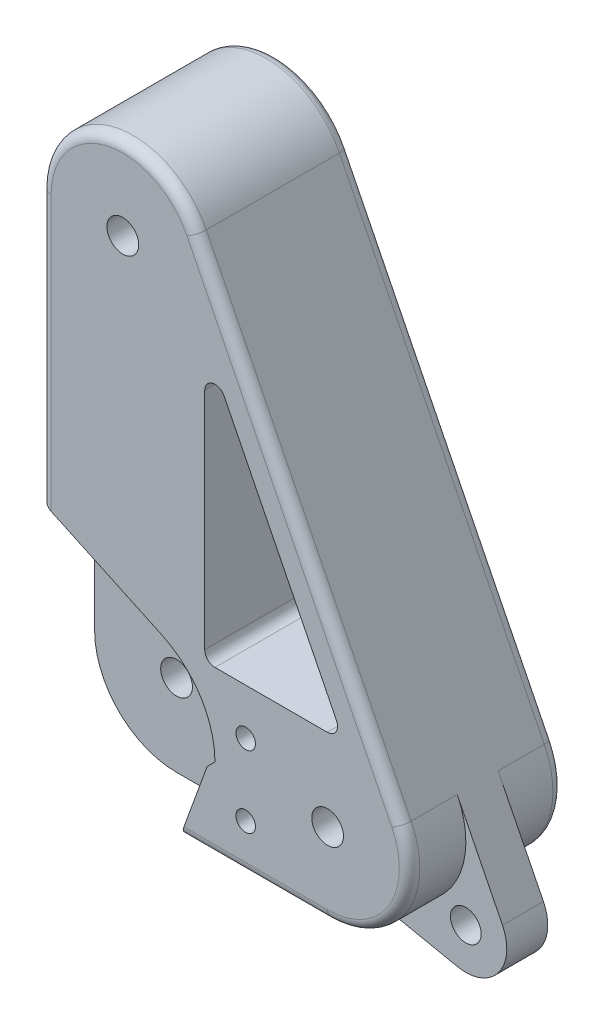
from build123d import *

# Parameters (mm, degrees)
SKETCH1_R                = 1.55
BOSS_EXTRUDE1_DEPTH      = 15
FILLET1_R                = 1
FILLET2_R                = 1
CUT_EXTRUDE1_DEPTH       = 5.25
BOSS_EXTRUDE2_DEPTH      = 2
BOSS_EXTRUDE2_DEPTH_BACK = 2
SKETCH3_R                = 1.5
SKETCH4_R                = 0.95
CUT_EXTRUDE2_DEPTH       = 60.605329072
CUT_EXTRUDE3_DEPTH       = 60.605329072
FILLET3_R                = 1


with BuildPart() as part:
    # Sketch1 → Boss-Extrude1 (new body)
    with BuildSketch(Plane.XY):
        with BuildLine():
            Line((20, -8), (0, -8))
            ThreePointArc((0, -8), (-5.656854249, -5.656854249), (-8, 0))
            Line((-8, 0), (-8, 40))
            ThreePointArc((-8, 40), (-1.838023364, 47.785991916), (7.155417528, 43.577708764))
            Line((7.155417528, 43.577708764), (27.155417528, 3.577708764))
            ThreePointArc((27.155417528, 3.577708764), (26.805206467, -4.205848897), (20, -8))
        make_face()
        Circle(SKETCH1_R, mode=Mode.SUBTRACT)
        with Locations((20, 0)):
            Circle(SKETCH1_R, mode=Mode.SUBTRACT)
        with Locations((0, 40)):
            Circle(SKETCH1_R, mode=Mode.SUBTRACT)
    extrude(amount=BOSS_EXTRUDE1_DEPTH)

    # Fillet1
    fillet1_edges = [part.edges().sort_by_distance(p)[0] for p in [
        (-8, 20, 0),
        (-1.838023364, 47.785991916, 0),
        (17.155417528, 23.577708764, 0),
        (26.805206467, -4.205848897, 0),
        (10, -8, 0),
        (-5.656854249, -5.656854249, 0),
    ]]
    fillet(fillet1_edges, radius=FILLET1_R)

    # Fillet2
    fillet2_edges = [part.edges().sort_by_distance(p)[0] for p in [
        (26.805206467, -4.205848897, 15),
        (17.155417528, 23.577708764, 15),
        (-1.838023364, 47.785991916, 15),
        (-8, 20, 15),
        (-5.656854249, -5.656854249, 15),
        (10, -8, 15),
    ]]
    fillet(fillet2_edges, radius=FILLET2_R)

    # Sketch2 → Cut-Extrude1 (cut)
    with BuildSketch(Plane.XY.offset(15)):
        with BuildLine():
            Line((5.601660306, -8), (-8, -8))
            Line((-8, -8), (-8, 13.660862536))
            Line((-8, 13.660862536), (3.803564356, 8.156770083))
            ThreePointArc((3.803564356, 8.156770083), (7.590523012, 4.835696475), (9, 0))
            Line((9, 0), (8.234976339, -0.765023661))
            Line((8.234976339, -0.765023661), (5.601660306, -8))
        make_face()
    cut_extrude1 = extrude(amount=-CUT_EXTRUDE1_DEPTH, mode=Mode.SUBTRACT)

    # Mirror1: Cut-Extrude1 across plane
    add(cut_extrude1.mirror(Plane.XY.offset(7.5)), mode=Mode.SUBTRACT)

    # Sketch3 → Boss-Extrude2 (add, two sides: drawn at the far end of the back side and taken through both)
    with BuildSketch(Plane.XY.offset(7.5).offset(-BOSS_EXTRUDE2_DEPTH_BACK)):
        with BuildLine():
            Line((31.574509444, -5.260475068), (27.155417528, 3.577708764))
            Line((27.155417528, 3.577708764), (12.800830153, -8))
            Line((12.800830153, -8), (27.18897642, -10.966907779))
            ThreePointArc((27.18897642, -10.966907779), (31.168378933, -9.486764863), (31.574509444, -5.260475068))
        make_face()
        with Locations((27.99680068, -7.04932945)):
            Circle(SKETCH3_R, mode=Mode.SUBTRACT)
    extrude(amount=BOSS_EXTRUDE2_DEPTH + BOSS_EXTRUDE2_DEPTH_BACK)

    # Sketch4 → Cut-Extrude2 (cut, through all)
    with BuildSketch(Plane(origin=(0, 0, 0), x_dir=(-1, 0, 0), z_dir=(0, 0, -1))):
        with Locations((-12, 3.5)):
            Circle(SKETCH4_R)
        with Locations(Location((-12, -3.5, 0), (0, 0, 180))):
            Circle(SKETCH4_R)
    extrude(amount=-CUT_EXTRUDE2_DEPTH, mode=Mode.SUBTRACT)

    # Sketch5 → Cut-Extrude3 (cut, through all)
    with BuildSketch(Plane(origin=(0, 0, 0), x_dir=(-1, 0, 0), z_dir=(0, 0, -1))):
        with BuildLine():
            Line((-8, 35.180339887), (-8, 8))
            Line((-8, 8), (-20, 8))
            ThreePointArc((-20, 8), (-20.844360125, 7.955316209), (-21.679287946, 7.821763995))
            Line((-21.679287946, 7.821763995), (-8, 35.180339887))
        make_face()
    extrude(amount=-CUT_EXTRUDE3_DEPTH, mode=Mode.SUBTRACT)

    # Fillet3
    fillet3_edges = [part.edges().sort_by_distance(p)[0] for p in [
        (8, 35.180339887, 7.5),
        (8, 8, 7.5),
        (21.679287946, 7.821763995, 7.5),
    ]]
    fillet(fillet3_edges, radius=FILLET3_R)


solid = part.part
